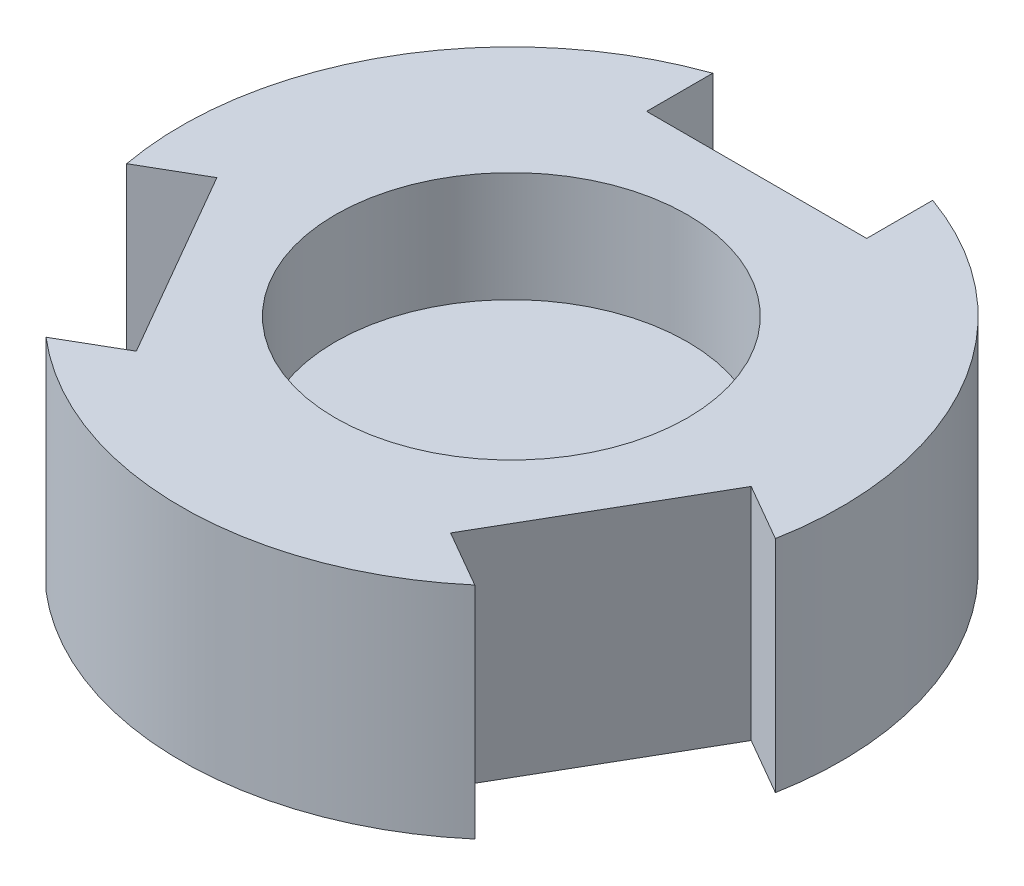
from build123d import *

# Parameters (mm, degrees)
SKETCH1_R           = 15
BOSS_EXTRUDE1_DEPTH = 10
SKETCH2_R           = 8
CUT_EXTRUDE1_DEPTH  = 5
CUT_EXTRUDE2_REACH  = 25.452


with BuildPart() as part:
    # Sketch1 → Boss-Extrude1 (new body)
    with BuildSketch(Plane(origin=(0, 0, 0), x_dir=(1, 0, 0), z_dir=(0, 1, 0))):
        with Locations(Location((0, 0, 0), (0, 0, 270))):
            Circle(SKETCH1_R)
    extrude(amount=BOSS_EXTRUDE1_DEPTH)

    # Sketch2 → Cut-Extrude1 (cut)
    with BuildSketch(Plane(origin=(0, 10, 0), x_dir=(1, 0, 0), z_dir=(0, 1, 0))):
        with Locations(Location((0, 0, 0), (0, 0, 270))):
            Circle(SKETCH2_R)
    extrude(amount=-CUT_EXTRUDE1_DEPTH, mode=Mode.SUBTRACT)

    # Sketch3 → Cut-Extrude2 (cut, up to next)
    with BuildSketch(Plane(origin=(0, 10, 0), x_dir=(1, 0, 0), z_dir=(0, 1, 0)), mode=Mode.PRIVATE) as cut_extrude2_sk1:
        Polygon((-4.993128311, 14.139704236), (-4.993128311, 16.53849836), (5.006871689, 16.53849836), (5.006871689, 14.139704236), (5.006871689, 11.139704236), (-4.993128311, 11.139704236), align=None)
    cut_extrude2_tool1 = extrude(cut_extrude2_sk1.sketch, amount=-CUT_EXTRUDE2_REACH, mode=Mode.PRIVATE) & part.part
    # Sketch3 → Cut-Extrude2 (cut, up to next)
    with BuildSketch(Plane(origin=(0, 10, 0), x_dir=(1, 0, 0), z_dir=(0, 1, 0)), mode=Mode.PRIVATE) as cut_extrude2_sk2:
        Polygon((9.741907226, -11.405930195), (7.143831014, -9.905930195), (12.143831014, -1.245676157), (14.741907226, -2.745676157), (16.819323876, -3.945073219), (11.819323876, -12.605327257), align=None)
    cut_extrude2_tool2 = extrude(cut_extrude2_sk2.sketch, amount=-CUT_EXTRUDE2_REACH, mode=Mode.PRIVATE) & part.part
    # Sketch3 → Cut-Extrude2 (cut, up to next)
    with BuildSketch(Plane(origin=(0, 10, 0), x_dir=(1, 0, 0), z_dir=(0, 1, 0)), mode=Mode.PRIVATE) as cut_extrude2_sk3:
        Polygon((-14.748778915, -2.733774042), (-12.150702704, -1.233774042), (-7.150702704, -9.894028079), (-9.748778915, -11.394028079), (-11.826195565, -12.593425141), (-16.826195565, -3.933171104), align=None)
    cut_extrude2_tool3 = extrude(cut_extrude2_sk3.sketch, amount=-CUT_EXTRUDE2_REACH, mode=Mode.PRIVATE) & part.part
    add(cut_extrude2_tool1.solids().sort_by_distance((0.006872, 10, -13.839101))[0], mode=Mode.SUBTRACT)
    add(cut_extrude2_tool2.solids().sort_by_distance((11.981577, 10, 6.925502))[0], mode=Mode.SUBTRACT)
    add(cut_extrude2_tool3.solids().sort_by_distance((-11.988449, 10, 6.9136))[0], mode=Mode.SUBTRACT)


solid = part.part
